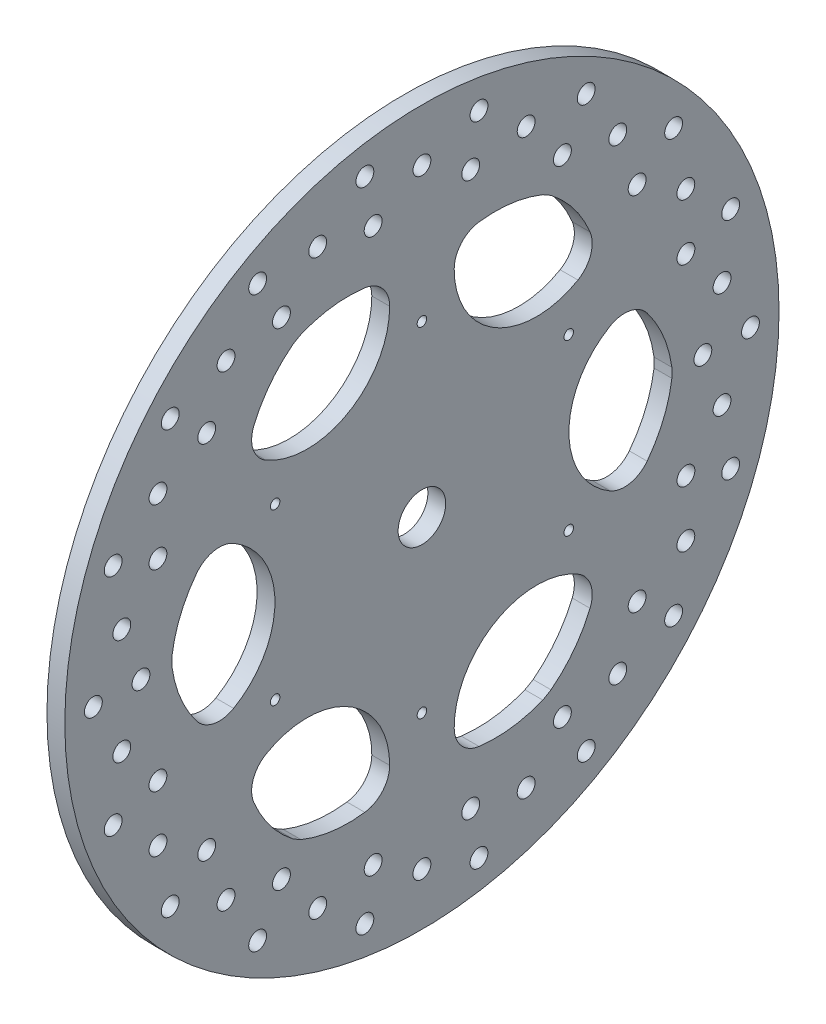
from build123d import *

# Parameters (mm, degrees)
SKETCH1_R           = 95.25
SKETCH1_R_2         = 66.675
MAIN_ROTOR_DEPTH    = 4.7625
SKETCH2_R           = 2.38125
CUT_SLOTS_DEPTH     = 135.788005424
BOSS_EXTRUDE2_START = -4.7625
SKETCH3_R           = 6.35
BOSS_EXTRUDE2_DEPTH = 4.7625
SKETCH4_R           = 1.27
CUT_EXTRUDE2_DEPTH  = 135.788005424


with BuildPart() as part:
    # Sketch1 → Main Rotor (new body)
    with BuildSketch(Plane(origin=(0, 0, 0), x_dir=(0, 0, -1), z_dir=(1, 0, 0))):
        with Locations(Location((0, 0, 0), (0, 0, 180))):
            Circle(SKETCH1_R)
        with Locations(Location((0, 0, 0), (0, 0, 180))):
            Circle(SKETCH1_R_2, mode=Mode.SUBTRACT)
    extrude(amount=MAIN_ROTOR_DEPTH)

    # Sketch2 → Cut Slots (cut, through all)
    with BuildSketch(Plane(origin=(4.7625, 0, 0), x_dir=(0, 0, -1), z_dir=(1, 0, 0))):
        with Locations((-80.045174165, 14.114123881)):
            Circle(SKETCH2_R)
        with Locations((-82.345264359, 29.97122516)):
            Circle(SKETCH2_R)
        with Locations((-70.411168075, 25.627569339)):
            Circle(SKETCH2_R)
        with Locations((-70.39054482, 40.64)):
            Circle(SKETCH2_R)
        with Locations((-67.128474551, 56.327478237)):
            Circle(SKETCH2_R)
        with Locations((-57.399710123, 48.164075594)):
            Circle(SKETCH2_R)
        with Locations((-52.245776915, 62.264092337)):
            Circle(SKETCH2_R)
        with Locations((-87.63, 0)):
            Circle(SKETCH2_R)
        with Locations((-43.815, 75.889806134)):
            Circle(SKETCH2_R)
        with Locations((-37.465, 64.891283506)):
            Circle(SKETCH2_R)
        with Locations((-74.93, 0)):
            Circle(SKETCH2_R)
        with Locations((-27.79939725, 76.378216217)):
            Circle(SKETCH2_R)
        with Locations((-15.216789809, 86.298703396)):
            Circle(SKETCH2_R)
        with Locations((-13.011457953, 73.791644933)):
            Circle(SKETCH2_R)
        with Locations((0, 81.28)):
            Circle(SKETCH2_R)
        with Locations((15.216789809, 86.298703396)):
            Circle(SKETCH2_R)
        with Locations((13.011457953, 73.791644933)):
            Circle(SKETCH2_R)
        with Locations((27.79939725, 76.378216217)):
            Circle(SKETCH2_R)
        with Locations((43.815, 75.889806134)):
            Circle(SKETCH2_R)
        with Locations((37.465, 64.891283506)):
            Circle(SKETCH2_R)
        with Locations((52.245776915, 62.264092337)):
            Circle(SKETCH2_R)
        with Locations((67.128474551, 56.327478237)):
            Circle(SKETCH2_R)
        with Locations((57.399710123, 48.164075594)):
            Circle(SKETCH2_R)
        with Locations((70.39054482, 40.64)):
            Circle(SKETCH2_R)
        with Locations((82.345264359, 29.97122516)):
            Circle(SKETCH2_R)
        with Locations((70.411168075, 25.627569339)):
            Circle(SKETCH2_R)
        with Locations((80.045174165, 14.114123881)):
            Circle(SKETCH2_R)
        with Locations((87.63, 0)):
            Circle(SKETCH2_R)
        with Locations((74.93, 0)):
            Circle(SKETCH2_R)
        with Locations((80.045174165, -14.114123881)):
            Circle(SKETCH2_R)
        with Locations((82.345264359, -29.97122516)):
            Circle(SKETCH2_R)
        with Locations((70.411168075, -25.627569339)):
            Circle(SKETCH2_R)
        with Locations((70.39054482, -40.64)):
            Circle(SKETCH2_R)
        with Locations((67.128474551, -56.327478237)):
            Circle(SKETCH2_R)
        with Locations((57.399710123, -48.164075594)):
            Circle(SKETCH2_R)
        with Locations((52.245776915, -62.264092337)):
            Circle(SKETCH2_R)
        with Locations((43.815, -75.889806134)):
            Circle(SKETCH2_R)
        with Locations((37.465, -64.891283506)):
            Circle(SKETCH2_R)
        with Locations((27.79939725, -76.378216217)):
            Circle(SKETCH2_R)
        with Locations((15.216789809, -86.298703396)):
            Circle(SKETCH2_R)
        with Locations((13.011457953, -73.791644933)):
            Circle(SKETCH2_R)
        with Locations((0, -81.28)):
            Circle(SKETCH2_R)
        with Locations((-15.216789809, -86.298703396)):
            Circle(SKETCH2_R)
        with Locations((-13.011457953, -73.791644933)):
            Circle(SKETCH2_R)
        with Locations((-27.79939725, -76.378216217)):
            Circle(SKETCH2_R)
        with Locations((-43.815, -75.889806134)):
            Circle(SKETCH2_R)
        with Locations((-37.465, -64.891283506)):
            Circle(SKETCH2_R)
        with Locations((-52.245776915, -62.264092337)):
            Circle(SKETCH2_R)
        with Locations((-67.128474551, -56.327478237)):
            Circle(SKETCH2_R)
        with Locations((-57.399710123, -48.164075594)):
            Circle(SKETCH2_R)
        with Locations((-70.39054482, -40.64)):
            Circle(SKETCH2_R)
        with Locations((-82.345264359, -29.97122516)):
            Circle(SKETCH2_R)
        with Locations((-70.411168075, -25.627569339)):
            Circle(SKETCH2_R)
        with Locations((-80.045174165, -14.114123881)):
            Circle(SKETCH2_R)
    extrude(amount=-CUT_SLOTS_DEPTH, mode=Mode.SUBTRACT)

    # Sketch3 → Boss-Extrude2 (add)
    with BuildSketch(Plane(origin=(4.7625, 0, 0), x_dir=(0, 0, -1), z_dir=(1, 0, 0)).offset(BOSS_EXTRUDE2_START)):
        with BuildLine():
            ThreePointArc((15.226370254, -60.56863172), (10.49630902, -58.039692226), (8.604258147, -53.0208121))
            ThreePointArc((8.604258147, -53.0208121), (11.546477683, -42.011879168), (19.60245, -33.952439353))
            ThreePointArc((19.60245, -33.952439353), (30.610115778, -31.005482581), (41.615241134, -33.961912186))
            ThreePointArc((41.615241134, -33.961912186), (45.015693386, -38.109916371), (44.840788615, -43.470739307))
            ThreePointArc((44.840788615, -43.470739307), (40.527102575, -50.964468228), (34.431304095, -57.096768064))
            ThreePointArc((34.431304095, -57.096768064), (57.742243797, -33.3375), (66.662903665, -1.27))
            ThreePointArc((66.662903665, -1.27), (64.400075463, -9.615266258), (60.067158869, -17.097892412))
            ThreePointArc((60.067158869, -17.097892412), (55.512002406, -19.929775856), (50.219499281, -19.058899914))
            ThreePointArc((50.219499281, -19.058899914), (42.156593461, -11.006396586), (39.2049, 0))
            ThreePointArc((39.2049, 0), (42.156593461, 11.006396586), (50.219499281, 19.058899914))
            ThreePointArc((50.219499281, 19.058899914), (55.512002406, 19.929775856), (60.067158869, 17.097892412))
            ThreePointArc((60.067158869, 17.097892412), (64.400075463, 9.615266258), (66.662903665, 1.27))
            ThreePointArc((66.662903665, 1.27), (57.742243797, 33.3375), (34.431304095, 57.096768064))
            ThreePointArc((34.431304095, 57.096768064), (40.527102575, 50.964468228), (44.840788615, 43.470739307))
            ThreePointArc((44.840788615, 43.470739307), (45.015693386, 38.109916371), (41.615241134, 33.961912186))
            ThreePointArc((41.615241134, 33.961912186), (30.610115778, 31.005482581), (19.60245, 33.952439353))
            ThreePointArc((19.60245, 33.952439353), (11.546477683, 42.011879168), (8.604258147, 53.0208121))
            ThreePointArc((8.604258147, 53.0208121), (10.49630902, 58.039692226), (15.226370254, 60.56863172))
            ThreePointArc((15.226370254, 60.56863172), (23.872972888, 60.579734486), (32.23159957, 58.366768064))
            ThreePointArc((32.23159957, 58.366768064), (0, 66.675), (-32.23159957, 58.366768064))
            ThreePointArc((-32.23159957, 58.366768064), (-23.872972888, 60.579734486), (-15.226370254, 60.56863172))
            ThreePointArc((-15.226370254, 60.56863172), (-10.49630902, 58.039692226), (-8.604258147, 53.0208121))
            ThreePointArc((-8.604258147, 53.0208121), (-11.546477683, 42.011879168), (-19.60245, 33.952439353))
            ThreePointArc((-19.60245, 33.952439353), (-30.610115778, 31.005482581), (-41.615241134, 33.961912186))
            ThreePointArc((-41.615241134, 33.961912186), (-45.015693386, 38.109916371), (-44.840788615, 43.470739307))
            ThreePointArc((-44.840788615, 43.470739307), (-40.527102575, 50.964468228), (-34.431304095, 57.096768064))
            ThreePointArc((-34.431304095, 57.096768064), (-57.742243797, 33.3375), (-66.662903665, 1.27))
            ThreePointArc((-66.662903665, 1.27), (-64.400075463, 9.615266258), (-60.067158869, 17.097892412))
            ThreePointArc((-60.067158869, 17.097892412), (-55.512002406, 19.929775856), (-50.219499281, 19.058899914))
            ThreePointArc((-50.219499281, 19.058899914), (-42.156593461, 11.006396586), (-39.2049, 0))
            ThreePointArc((-39.2049, 0), (-42.156593461, -11.006396586), (-50.219499281, -19.058899914))
            ThreePointArc((-50.219499281, -19.058899914), (-55.512002406, -19.929775856), (-60.067158869, -17.097892412))
            ThreePointArc((-60.067158869, -17.097892412), (-64.400075463, -9.615266258), (-66.662903665, -1.27))
            ThreePointArc((-66.662903665, -1.27), (-57.742243797, -33.3375), (-34.431304095, -57.096768064))
            ThreePointArc((-34.431304095, -57.096768064), (-40.527102575, -50.964468228), (-44.840788615, -43.470739307))
            ThreePointArc((-44.840788615, -43.470739307), (-45.015693386, -38.109916371), (-41.615241134, -33.961912186))
            ThreePointArc((-41.615241134, -33.961912186), (-30.610115778, -31.005482581), (-19.60245, -33.952439353))
            ThreePointArc((-19.60245, -33.952439353), (-11.546477683, -42.011879168), (-8.604258147, -53.0208121))
            ThreePointArc((-8.604258147, -53.0208121), (-10.49630902, -58.039692226), (-15.226370254, -60.56863172))
            ThreePointArc((-15.226370254, -60.56863172), (-23.872972888, -60.579734486), (-32.23159957, -58.366768064))
            ThreePointArc((-32.23159957, -58.366768064), (0, -66.675), (32.23159957, -58.366768064))
            ThreePointArc((32.23159957, -58.366768064), (23.872972888, -60.579734486), (15.226370254, -60.56863172))
        make_face()
        Circle(SKETCH3_R, mode=Mode.SUBTRACT)
    extrude(amount=BOSS_EXTRUDE2_DEPTH)

    # Sketch4 → Cut-Extrude2 (cut, through all)
    with BuildSketch(Plane.ZY):
        with Locations((0, 45.212)):
            Circle(SKETCH4_R)
        with Locations((39.154740556, 22.606)):
            Circle(SKETCH4_R)
        with Locations((39.154740556, -22.606)):
            Circle(SKETCH4_R)
        with Locations((0, -45.212)):
            Circle(SKETCH4_R)
        with Locations((-39.154740556, -22.606)):
            Circle(SKETCH4_R)
        with Locations((-39.154740556, 22.606)):
            Circle(SKETCH4_R)
    extrude(amount=-CUT_EXTRUDE2_DEPTH, mode=Mode.SUBTRACT)


solid = part.part
